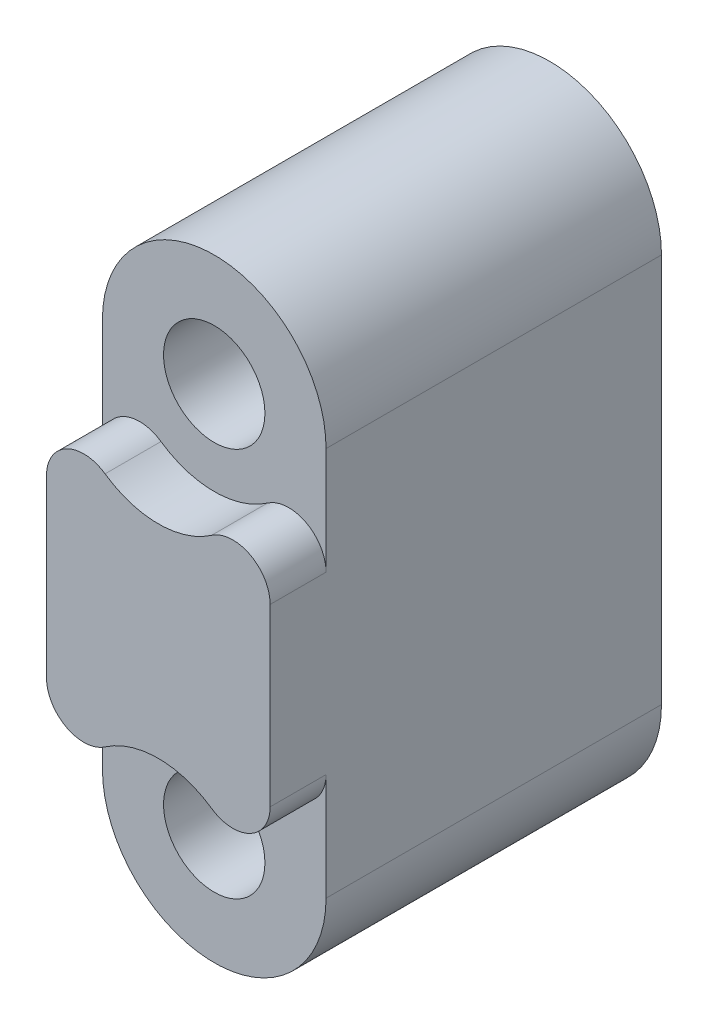
from build123d import *

# Parameters (mm, degrees)
BOSS_EXTRUDE1_DEPTH = 14.2875
SKETCH4_R           = 2.159
CUT_EXTRUDE2_DEPTH  = 27.126252203
BOSS_EXTRUDE3_DEPTH = 2.38125


with BuildPart() as part:
    # Sketch1 → Boss-Extrude1 (new body)
    with BuildSketch(Plane.XY):
        with BuildLine():
            Line((-4.7625, 0), (-4.7625, 16.5862))
            ThreePointArc((-4.7625, 16.5862), (0, 21.3487), (4.7625, 16.5862))
            Line((4.7625, 16.5862), (4.7625, 0))
            ThreePointArc((4.7625, 0), (0, -4.7625), (-4.7625, 0))
        make_face()
    extrude(amount=BOSS_EXTRUDE1_DEPTH)

    # Sketch4 → Cut-Extrude2 (cut, through all)
    with BuildSketch(Plane.XY.offset(14.2875)):
        with Locations((0, 16.5862)):
            Circle(SKETCH4_R)
        Circle(SKETCH4_R)
    extrude(amount=-CUT_EXTRUDE2_DEPTH, mode=Mode.SUBTRACT)

    # Sketch5 → Boss-Extrude3 (add)
    with BuildSketch(Plane.XY.offset(14.2875)):
        with BuildLine():
            Line((-4.7625, 4.559746601), (-4.7625, 12.026453399))
            ThreePointArc((-4.7625, 12.026453399), (-3.909869704, 13.43362175), (-2.267857143, 13.329238142))
            ThreePointArc((-2.267857143, 13.329238142), (0, 12.61745), (2.267857143, 13.329238142))
            ThreePointArc((2.267857143, 13.329238142), (3.909869704, 13.43362175), (4.7625, 12.026453399))
            Line((4.7625, 12.026453399), (4.7625, 4.559746601))
            ThreePointArc((4.7625, 4.559746601), (3.909869704, 3.15257825), (2.267857143, 3.256961858))
            ThreePointArc((2.267857143, 3.256961858), (0, 3.96875), (-2.267857143, 3.256961858))
            ThreePointArc((-2.267857143, 3.256961858), (-3.909869704, 3.15257825), (-4.7625, 4.559746601))
        make_face()
    extrude(amount=BOSS_EXTRUDE3_DEPTH)


solid = part.part
